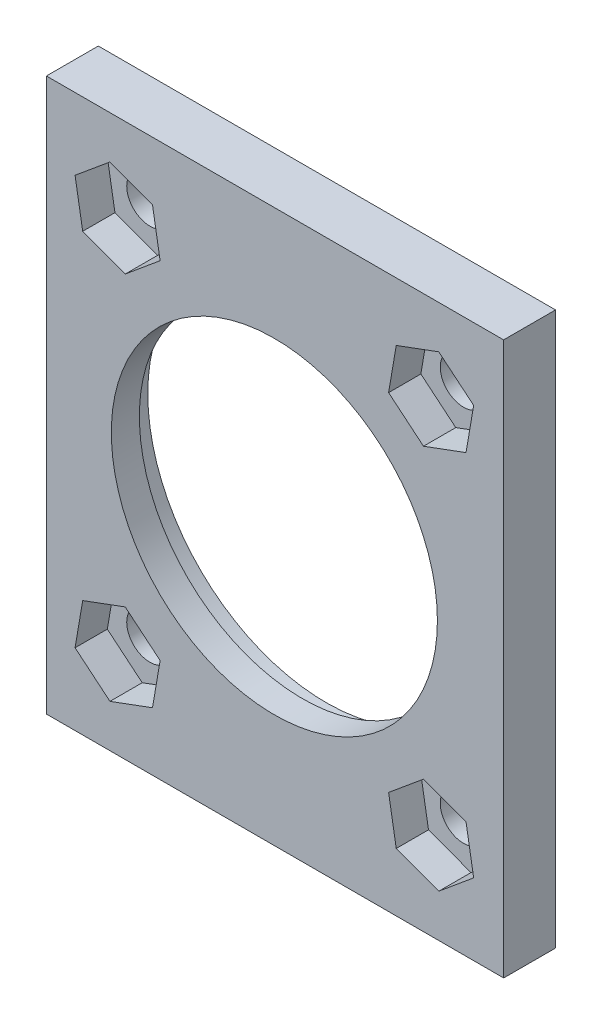
from build123d import *

# Parameters (mm, degrees)
SKETCH2_R           = 11.625
BOSS_EXTRUDE1_DEPTH = 2
SKETCH3_R           = 12.725
BOSS_EXTRUDE2_DEPTH = 1.7
CUT_EXTRUDE1_DEPTH  = 2.3
SKETCH5_R           = 1.65
CUT_EXTRUDE2_DEPTH  = 1.4


with BuildPart() as part:
    # Sketch2 → Boss-Extrude1 (new body)
    with BuildSketch(Plane.XY):
        Polygon((-16.247566177, -19.702007889), (-16.252434142, 19.697992436), (16.34566541, 19.70202001), (16.350533375, -19.697980315), align=None)
        Circle(SKETCH2_R, mode=Mode.SUBTRACT)
    extrude(amount=-BOSS_EXTRUDE1_DEPTH)

    # Sketch3 → Boss-Extrude2 (add)
    with BuildSketch(Plane(origin=(0, 0, -2), x_dir=(-1, 0, 0), z_dir=(0, 0, -1))):
        Polygon((-16.350533375, -19.697980315), (16.247566177, -19.702007889), (16.252434142, 19.697992436), (-16.34566541, 19.70202001), align=None)
        Circle(SKETCH3_R, mode=Mode.SUBTRACT)
    extrude(amount=BOSS_EXTRUDE2_DEPTH)

    # Sketch4 → Cut-Extrude1 (cut)
    with BuildSketch(Plane.XY):
        Polygon((10.632742825, -10.278526808), (8.144960808, -12.343538665), (8.689422526, -15.530527019), (11.721666262, -16.652503517), (14.209448279, -14.58749166), (13.664986561, -11.400503306), align=None)
        Polygon((13.664986561, 11.400503306), (10.632742825, 10.278526808), (8.144960808, 12.343538665), (8.689422526, 15.530527019), (11.721666262, 16.652503517), (14.209448279, 14.58749166), align=None)
        Polygon((-13.664986561, 11.400503306), (-10.632742825, 10.278526808), (-8.144960808, 12.343538665), (-8.689422526, 15.530527019), (-11.721666262, 16.652503517), (-14.209448279, 14.58749166), align=None)
        Polygon((-13.664986561, -11.400503306), (-10.632742825, -10.278526808), (-8.144960808, -12.343538665), (-8.689422526, -15.530527019), (-11.721666262, -16.652503517), (-14.209448279, -14.58749166), align=None)
    extrude(amount=-CUT_EXTRUDE1_DEPTH, mode=Mode.SUBTRACT)

    # Sketch5 → Cut-Extrude2 (cut)
    with BuildSketch(Plane(origin=(0, 0, -3.7), x_dir=(-1, 0, 0), z_dir=(0, 0, -1))):
        with Locations((-11.177204543, -13.465515163)):
            Circle(SKETCH5_R)
        with Locations((-11.177204543, 13.465515163)):
            Circle(SKETCH5_R)
        with Locations((11.177204543, 13.465515163)):
            Circle(SKETCH5_R)
        with Locations((11.177204543, -13.465515163)):
            Circle(SKETCH5_R)
    extrude(amount=-CUT_EXTRUDE2_DEPTH, mode=Mode.SUBTRACT)


solid = part.part
